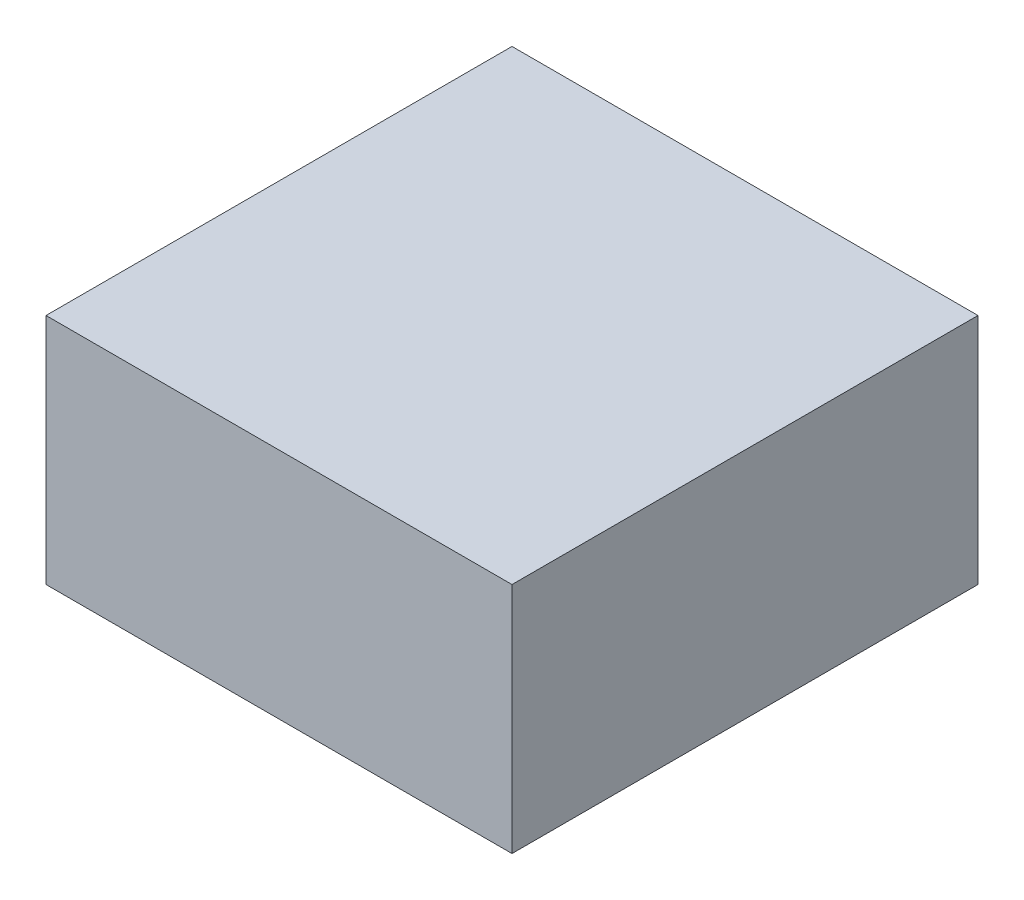
from build123d import *

# Parameters (mm, degrees)
SKETCH1_W           = 60
SKETCH1_H           = 60
BOSS_EXTRUDE1_DEPTH = 30


with BuildPart() as part:
    # Sketch1 → Boss-Extrude1 (new body)
    with BuildSketch(Plane(origin=(0, 0, 0), x_dir=(1, 0, 0), z_dir=(0, 1, 0))):
        with Locations((-4.234234234, 5.675675676)):
            Rectangle(SKETCH1_W, SKETCH1_H)
    extrude(amount=BOSS_EXTRUDE1_DEPTH)


solid = part.part
